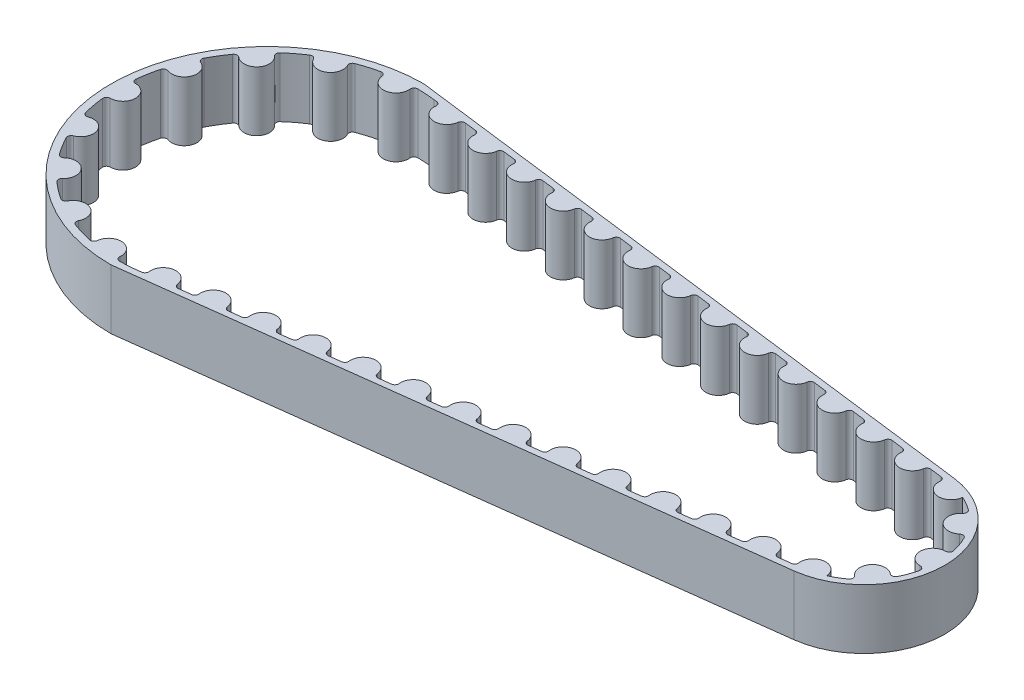
from build123d import *

# Parameters (mm, degrees)
EXTRUDE_1_DEPTH          = 8
EXTRUDE_2_DEPTH          = 8
PATTERN_LINEAR_2_COUNT   = 8
PATTERN_LINEAR_2_PITCH   = 6
PATTERN_LINEAR_3_COUNT   = 7
PATTERN_LINEAR_3_PITCH   = 6
MIRROR_6_COPY_1_DEPTH    = 8
MIRROR_6_COPY_2_DEPTH    = 8
MIRROR_6_COPY_3_DEPTH    = 8
MIRROR_6_COPY_4_DEPTH    = 8
MIRROR_6_COPY_5_DEPTH    = 8
MIRROR_6_COPY_6_DEPTH    = 8
MIRROR_7_COPY_1_DEPTH    = 8
MIRROR_7_COPY_2_DEPTH    = 8
MIRROR_7_COPY_3_DEPTH    = 8
MIRROR_7_COPY_4_DEPTH    = 8
MIRROR_7_COPY_5_DEPTH    = 8
MIRROR_7_COPY_6_DEPTH    = 8
MIRROR_7_COPY_7_DEPTH    = 8
MIRROR_7_COPY_8_DEPTH    = 8
EXTRUDE_4_DEPTH          = 8
PATTERN_CIRCULAR_1_COUNT = 5
PATTERN_CIRCULAR_1_ANGLE = 84
MIRROR_8_COPY_1_DEPTH    = 8
MIRROR_8_COPY_2_DEPTH    = 8
MIRROR_8_COPY_3_DEPTH    = 8
MIRROR_8_COPY_4_DEPTH    = 8
MIRROR_8_COPY_5_DEPTH    = 8
EXTRUDE_5_DEPTH          = 8
PATTERN_CIRCULAR_2_COUNT = 2
PATTERN_CIRCULAR_2_ANGLE = 40
MIRROR_9_COPY_1_DEPTH    = 8
MIRROR_9_COPY_2_DEPTH    = 8


with BuildPart() as part:
    # 草图1 → 凸台-拉伸1 (new body)
    with BuildSketch(Plane(origin=(0, 0, 0), x_dir=(1, 0, 0), z_dir=(0, 1, 0))):
        with BuildLine():
            Line((0, 21), (81.354447298, 10.74431259))
            ThreePointArc((81.354447298, 10.74431259), (90.829348112, 0), (81.354447298, -10.74431259))
            Line((81.354447298, -10.74431259), (0, -21))
            ThreePointArc((0, -21), (-21, 0), (0, 21))
        make_face()
        with BuildLine():
            Line((2.5, 19.843134833), (81.25, 9.921567416))
            ThreePointArc((81.25, 9.921567416), (90, 0), (81.25, -9.921567416))
            Line((81.25, -9.921567416), (2.5, -19.843134833))
            ThreePointArc((2.5, -19.843134833), (-20, 0), (2.5, 19.843134833))
        make_face(mode=Mode.SUBTRACT)
    extrude(amount=EXTRUDE_1_DEPTH)

    # 草图2 → 凸台-拉伸2 (add)
    with BuildSketch(Plane(origin=(0, 0, 0), x_dir=(1, 0, 0), z_dir=(0, 1, 0))):
        with BuildLine():
            Line((38.64552556, 15.28922666), (43.011015223, 14.73922666))
            ThreePointArc((43.011015223, 14.73922666), (42.641929017, 14.638122843), (42.452436852, 14.305648289))
            ThreePointArc((42.452436852, 14.305648289), (40.553270391, 12.831481828), (39.07910393, 14.730648289))
            ThreePointArc((39.07910393, 14.730648289), (38.978000113, 15.099734495), (38.64552556, 15.28922666))
        make_face()
    extrude_2 = extrude(amount=EXTRUDE_2_DEPTH)

    # 阵列(线性)2: 凸台-拉伸2 ×8
    with Locations(*[Vector(0.9921567416492215, 0, 0.12500000000000014) * (i * PATTERN_LINEAR_2_PITCH) for i in range(1, PATTERN_LINEAR_2_COUNT)]):
        add(extrude_2)

    # 阵列(线性)3: 凸台-拉伸2 ×7
    with Locations(*[Vector(-0.9921567416492215, 0, -0.12499999999999983) * (i * PATTERN_LINEAR_3_PITCH) for i in range(1, PATTERN_LINEAR_3_COUNT)]):
        add(extrude_2)

    # 镜向6: 凸台-拉伸2 across plane
    add(extrude_2.mirror(Plane.XY))

    # 镜向6 copy 1 sketch → 镜向6 copy 1 (add)
    with BuildSketch(Plane(origin=(-5.95294045, 0, 0.75), x_dir=(1, 0, 0), z_dir=(0, 1, 0))):
        with BuildLine():
            Line((38.64552556, -15.28922666), (43.011015223, -14.73922666))
            ThreePointArc((43.011015223, -14.73922666), (42.641929017, -14.638122843), (42.452436852, -14.305648289))
            ThreePointArc((42.452436852, -14.305648289), (40.553270391, -12.831481828), (39.07910393, -14.730648289))
            ThreePointArc((39.07910393, -14.730648289), (38.978000113, -15.099734495), (38.64552556, -15.28922666))
        make_face()
    extrude(amount=MIRROR_6_COPY_1_DEPTH)

    # 镜向6 copy 2 sketch → 镜向6 copy 2 (add)
    with BuildSketch(Plane(origin=(-11.9058809, 0, 1.5), x_dir=(1, 0, 0), z_dir=(0, 1, 0))):
        with BuildLine():
            Line((38.64552556, -15.28922666), (43.011015223, -14.73922666))
            ThreePointArc((43.011015223, -14.73922666), (42.641929017, -14.638122843), (42.452436852, -14.305648289))
            ThreePointArc((42.452436852, -14.305648289), (40.553270391, -12.831481828), (39.07910393, -14.730648289))
            ThreePointArc((39.07910393, -14.730648289), (38.978000113, -15.099734495), (38.64552556, -15.28922666))
        make_face()
    extrude(amount=MIRROR_6_COPY_2_DEPTH)

    # 镜向6 copy 3 sketch → 镜向6 copy 3 (add)
    with BuildSketch(Plane(origin=(-17.85882135, 0, 2.25), x_dir=(1, 0, 0), z_dir=(0, 1, 0))):
        with BuildLine():
            Line((38.64552556, -15.28922666), (43.011015223, -14.73922666))
            ThreePointArc((43.011015223, -14.73922666), (42.641929017, -14.638122843), (42.452436852, -14.305648289))
            ThreePointArc((42.452436852, -14.305648289), (40.553270391, -12.831481828), (39.07910393, -14.730648289))
            ThreePointArc((39.07910393, -14.730648289), (38.978000113, -15.099734495), (38.64552556, -15.28922666))
        make_face()
    extrude(amount=MIRROR_6_COPY_3_DEPTH)

    # 镜向6 copy 4 sketch → 镜向6 copy 4 (add)
    with BuildSketch(Plane(origin=(-23.8117618, 0, 3), x_dir=(1, 0, 0), z_dir=(0, 1, 0))):
        with BuildLine():
            Line((38.64552556, -15.28922666), (43.011015223, -14.73922666))
            ThreePointArc((43.011015223, -14.73922666), (42.641929017, -14.638122843), (42.452436852, -14.305648289))
            ThreePointArc((42.452436852, -14.305648289), (40.553270391, -12.831481828), (39.07910393, -14.730648289))
            ThreePointArc((39.07910393, -14.730648289), (38.978000113, -15.099734495), (38.64552556, -15.28922666))
        make_face()
    extrude(amount=MIRROR_6_COPY_4_DEPTH)

    # 镜向6 copy 5 sketch → 镜向6 copy 5 (add)
    with BuildSketch(Plane(origin=(-29.764702249, 0, 3.75), x_dir=(1, 0, 0), z_dir=(0, 1, 0))):
        with BuildLine():
            Line((38.64552556, -15.28922666), (43.011015223, -14.73922666))
            ThreePointArc((43.011015223, -14.73922666), (42.641929017, -14.638122843), (42.452436852, -14.305648289))
            ThreePointArc((42.452436852, -14.305648289), (40.553270391, -12.831481828), (39.07910393, -14.730648289))
            ThreePointArc((39.07910393, -14.730648289), (38.978000113, -15.099734495), (38.64552556, -15.28922666))
        make_face()
    extrude(amount=MIRROR_6_COPY_5_DEPTH)

    # 镜向6 copy 6 sketch → 镜向6 copy 6 (add)
    with BuildSketch(Plane(origin=(-35.717642699, 0, 4.5), x_dir=(1, 0, 0), z_dir=(0, 1, 0))):
        with BuildLine():
            Line((38.64552556, -15.28922666), (43.011015223, -14.73922666))
            ThreePointArc((43.011015223, -14.73922666), (42.641929017, -14.638122843), (42.452436852, -14.305648289))
            ThreePointArc((42.452436852, -14.305648289), (40.553270391, -12.831481828), (39.07910393, -14.730648289))
            ThreePointArc((39.07910393, -14.730648289), (38.978000113, -15.099734495), (38.64552556, -15.28922666))
        make_face()
    extrude(amount=MIRROR_6_COPY_6_DEPTH)

    # 镜向7 copy 1 sketch → 镜向7 copy 1 (add)
    with BuildSketch(Plane(origin=(5.95294045, 0, -0.75), x_dir=(1, 0, 0), z_dir=(0, 1, 0))):
        with BuildLine():
            Line((38.64552556, -15.28922666), (43.011015223, -14.73922666))
            ThreePointArc((43.011015223, -14.73922666), (42.641929017, -14.638122843), (42.452436852, -14.305648289))
            ThreePointArc((42.452436852, -14.305648289), (40.553270391, -12.831481828), (39.07910393, -14.730648289))
            ThreePointArc((39.07910393, -14.730648289), (38.978000113, -15.099734495), (38.64552556, -15.28922666))
        make_face()
    extrude(amount=MIRROR_7_COPY_1_DEPTH)

    # 镜向7 copy 2 sketch → 镜向7 copy 2 (add)
    with BuildSketch(Plane(origin=(11.9058809, 0, -1.5), x_dir=(1, 0, 0), z_dir=(0, 1, 0))):
        with BuildLine():
            Line((38.64552556, -15.28922666), (43.011015223, -14.73922666))
            ThreePointArc((43.011015223, -14.73922666), (42.641929017, -14.638122843), (42.452436852, -14.305648289))
            ThreePointArc((42.452436852, -14.305648289), (40.553270391, -12.831481828), (39.07910393, -14.730648289))
            ThreePointArc((39.07910393, -14.730648289), (38.978000113, -15.099734495), (38.64552556, -15.28922666))
        make_face()
    extrude(amount=MIRROR_7_COPY_2_DEPTH)

    # 镜向7 copy 3 sketch → 镜向7 copy 3 (add)
    with BuildSketch(Plane(origin=(17.85882135, 0, -2.25), x_dir=(1, 0, 0), z_dir=(0, 1, 0))):
        with BuildLine():
            Line((38.64552556, -15.28922666), (43.011015223, -14.73922666))
            ThreePointArc((43.011015223, -14.73922666), (42.641929017, -14.638122843), (42.452436852, -14.305648289))
            ThreePointArc((42.452436852, -14.305648289), (40.553270391, -12.831481828), (39.07910393, -14.730648289))
            ThreePointArc((39.07910393, -14.730648289), (38.978000113, -15.099734495), (38.64552556, -15.28922666))
        make_face()
    extrude(amount=MIRROR_7_COPY_3_DEPTH)

    # 镜向7 copy 4 sketch → 镜向7 copy 4 (add)
    with BuildSketch(Plane(origin=(23.8117618, 0, -3), x_dir=(1, 0, 0), z_dir=(0, 1, 0))):
        with BuildLine():
            Line((38.64552556, -15.28922666), (43.011015223, -14.73922666))
            ThreePointArc((43.011015223, -14.73922666), (42.641929017, -14.638122843), (42.452436852, -14.305648289))
            ThreePointArc((42.452436852, -14.305648289), (40.553270391, -12.831481828), (39.07910393, -14.730648289))
            ThreePointArc((39.07910393, -14.730648289), (38.978000113, -15.099734495), (38.64552556, -15.28922666))
        make_face()
    extrude(amount=MIRROR_7_COPY_4_DEPTH)

    # 镜向7 copy 5 sketch → 镜向7 copy 5 (add)
    with BuildSketch(Plane(origin=(29.764702249, 0, -3.75), x_dir=(1, 0, 0), z_dir=(0, 1, 0))):
        with BuildLine():
            Line((38.64552556, -15.28922666), (43.011015223, -14.73922666))
            ThreePointArc((43.011015223, -14.73922666), (42.641929017, -14.638122843), (42.452436852, -14.305648289))
            ThreePointArc((42.452436852, -14.305648289), (40.553270391, -12.831481828), (39.07910393, -14.730648289))
            ThreePointArc((39.07910393, -14.730648289), (38.978000113, -15.099734495), (38.64552556, -15.28922666))
        make_face()
    extrude(amount=MIRROR_7_COPY_5_DEPTH)

    # 镜向7 copy 6 sketch → 镜向7 copy 6 (add)
    with BuildSketch(Plane(origin=(35.717642699, 0, -4.5), x_dir=(1, 0, 0), z_dir=(0, 1, 0))):
        with BuildLine():
            Line((38.64552556, -15.28922666), (43.011015223, -14.73922666))
            ThreePointArc((43.011015223, -14.73922666), (42.641929017, -14.638122843), (42.452436852, -14.305648289))
            ThreePointArc((42.452436852, -14.305648289), (40.553270391, -12.831481828), (39.07910393, -14.730648289))
            ThreePointArc((39.07910393, -14.730648289), (38.978000113, -15.099734495), (38.64552556, -15.28922666))
        make_face()
    extrude(amount=MIRROR_7_COPY_6_DEPTH)

    # 镜向7 copy 7 sketch → 镜向7 copy 7 (add)
    with BuildSketch(Plane(origin=(41.670583149, 0, -5.25), x_dir=(1, 0, 0), z_dir=(0, 1, 0))):
        with BuildLine():
            Line((38.64552556, -15.28922666), (43.011015223, -14.73922666))
            ThreePointArc((43.011015223, -14.73922666), (42.641929017, -14.638122843), (42.452436852, -14.305648289))
            ThreePointArc((42.452436852, -14.305648289), (40.553270391, -12.831481828), (39.07910393, -14.730648289))
            ThreePointArc((39.07910393, -14.730648289), (38.978000113, -15.099734495), (38.64552556, -15.28922666))
        make_face()
    extrude(amount=MIRROR_7_COPY_7_DEPTH)

    # 镜向7 copy 8 sketch → 镜向7 copy 8 (add)
    with BuildSketch(Plane(origin=(0, 0, 0), x_dir=(1, 0, 0), z_dir=(0, 1, 0))):
        with BuildLine():
            Line((38.64552556, -15.28922666), (43.011015223, -14.73922666))
            ThreePointArc((43.011015223, -14.73922666), (42.641929017, -14.638122843), (42.452436852, -14.305648289))
            ThreePointArc((42.452436852, -14.305648289), (40.553270391, -12.831481828), (39.07910393, -14.730648289))
            ThreePointArc((39.07910393, -14.730648289), (38.978000113, -15.099734495), (38.64552556, -15.28922666))
        make_face()
    extrude(amount=MIRROR_7_COPY_8_DEPTH)

    # 草图3 → 凸台-拉伸4 (add)
    with BuildSketch(Plane(origin=(0, 0, 0), x_dir=(1, 0, 0), z_dir=(0, 1, 0))):
        with BuildLine():
            ThreePointArc((-19.375499994, -1.7), (-17.675499994, 0), (-19.375499994, 1.7))
            ThreePointArc((-19.375499994, 1.7), (-19.748464555, 1.866987334), (-19.872307686, 2.256410256))
            ThreePointArc((-19.872307686, 2.256410256), (-20, 0), (-19.872307686, -2.256410256))
            ThreePointArc((-19.872307686, -2.256410256), (-19.748464555, -1.866987334), (-19.375499994, -1.7))
        make_face()
    extrude_4 = extrude(amount=EXTRUDE_4_DEPTH)

    # 阵列(圆周)1: 凸台-拉伸4 ×5 about axis
    pattern_circular_1_axis = Axis((0, 0, 0), (0, 1, 0))
    for i in range(1, PATTERN_CIRCULAR_1_COUNT):
        add(extrude_4.rotate(pattern_circular_1_axis, i * PATTERN_CIRCULAR_1_ANGLE / (PATTERN_CIRCULAR_1_COUNT - 1)))

    # 镜向8 copy 1 sketch → 镜向8 copy 1 (add)
    with BuildSketch(Plane(origin=(0, 0, 0), x_dir=(0.9335804264972015, 0, 0.358367949545301), z_dir=(0, 1, 0))):
        with BuildLine():
            ThreePointArc((-19.375499994, 1.7), (-17.675499994, 0), (-19.375499994, -1.7))
            ThreePointArc((-19.375499994, -1.7), (-19.748464555, -1.866987334), (-19.872307686, -2.256410256))
            ThreePointArc((-19.872307686, -2.256410256), (-20, 0), (-19.872307686, 2.256410256))
            ThreePointArc((-19.872307686, 2.256410256), (-19.748464555, 1.866987334), (-19.375499994, 1.7))
        make_face()
    extrude(amount=MIRROR_8_COPY_1_DEPTH)

    # 镜向8 copy 2 sketch → 镜向8 copy 2 (add)
    with BuildSketch(Plane(origin=(0, 0, 0), x_dir=(0.7431448254773931, 0, 0.6691306063588593), z_dir=(0, 1, 0))):
        with BuildLine():
            ThreePointArc((-19.375499994, 1.7), (-17.675499994, 0), (-19.375499994, -1.7))
            ThreePointArc((-19.375499994, -1.7), (-19.748464555, -1.866987334), (-19.872307686, -2.256410256))
            ThreePointArc((-19.872307686, -2.256410256), (-20, 0), (-19.872307686, 2.256410256))
            ThreePointArc((-19.872307686, 2.256410256), (-19.748464555, 1.866987334), (-19.375499994, 1.7))
        make_face()
    extrude(amount=MIRROR_8_COPY_2_DEPTH)

    # 镜向8 copy 3 sketch → 镜向8 copy 3 (add)
    with BuildSketch(Plane(origin=(0, 0, 0), x_dir=(0.45399049973954464, 0, 0.8910065241883689), z_dir=(0, 1, 0))):
        with BuildLine():
            ThreePointArc((-19.375499994, 1.7), (-17.675499994, 0), (-19.375499994, -1.7))
            ThreePointArc((-19.375499994, -1.7), (-19.748464555, -1.866987334), (-19.872307686, -2.256410256))
            ThreePointArc((-19.872307686, -2.256410256), (-20, 0), (-19.872307686, 2.256410256))
            ThreePointArc((-19.872307686, 2.256410256), (-19.748464555, 1.866987334), (-19.375499994, 1.7))
        make_face()
    extrude(amount=MIRROR_8_COPY_3_DEPTH)

    # 镜向8 copy 4 sketch → 镜向8 copy 4 (add)
    with BuildSketch(Plane(origin=(0, 0, 0), x_dir=(0.10452846326765036, 0, 0.9945218953682736), z_dir=(0, 1, 0))):
        with BuildLine():
            ThreePointArc((-19.375499994, 1.7), (-17.675499994, 0), (-19.375499994, -1.7))
            ThreePointArc((-19.375499994, -1.7), (-19.748464555, -1.866987334), (-19.872307686, -2.256410256))
            ThreePointArc((-19.872307686, -2.256410256), (-20, 0), (-19.872307686, 2.256410256))
            ThreePointArc((-19.872307686, 2.256410256), (-19.748464555, 1.866987334), (-19.375499994, 1.7))
        make_face()
    extrude(amount=MIRROR_8_COPY_4_DEPTH)

    # 镜向8 copy 5 sketch → 镜向8 copy 5 (add)
    with BuildSketch(Plane(origin=(0, 0, 0), x_dir=(1, 0, 0), z_dir=(0, 1, 0))):
        with BuildLine():
            ThreePointArc((-19.375499994, 1.7), (-17.675499994, 0), (-19.375499994, -1.7))
            ThreePointArc((-19.375499994, -1.7), (-19.748464555, -1.866987334), (-19.872307686, -2.256410256))
            ThreePointArc((-19.872307686, -2.256410256), (-20, 0), (-19.872307686, 2.256410256))
            ThreePointArc((-19.872307686, 2.256410256), (-19.748464555, 1.866987334), (-19.375499994, 1.7))
        make_face()
    extrude(amount=MIRROR_8_COPY_5_DEPTH)

    # 草图4 → 凸台-拉伸5 (add)
    with BuildSketch(Plane(origin=(0, 0, 0), x_dir=(1, 0, 0), z_dir=(0, 1, 0))):
        with BuildLine():
            ThreePointArc((89.24175308, 1.7), (87.54175308, 0), (89.24175308, -1.7))
            ThreePointArc((89.24175308, -1.7), (89.634114353, -1.89007641), (89.728161137, -2.315789474))
            ThreePointArc((89.728161137, -2.315789474), (90, 0), (89.728161137, 2.315789474))
            ThreePointArc((89.728161137, 2.315789474), (89.634114353, 1.89007641), (89.24175308, 1.7))
        make_face()
    extrude_5 = extrude(amount=EXTRUDE_5_DEPTH)

    # 阵列(圆周)2: 凸台-拉伸5 ×2 about axis
    pattern_circular_2_axis = Axis((80, 0, 0), (0, 1, 0))
    for i in range(1, PATTERN_CIRCULAR_2_COUNT):
        add(extrude_5.rotate(pattern_circular_2_axis, i * PATTERN_CIRCULAR_2_ANGLE / (PATTERN_CIRCULAR_2_COUNT - 1)))

    # 镜向9 copy 1 sketch → 镜向9 copy 1 (add)
    with BuildSketch(Plane(origin=(18.71644455, 0, -51.423008775), x_dir=(0.766044443118977, 0, 0.6427876096865406), z_dir=(0, 1, 0))):
        with BuildLine():
            ThreePointArc((89.24175308, -1.7), (87.54175308, 0), (89.24175308, 1.7))
            ThreePointArc((89.24175308, 1.7), (89.634114353, 1.89007641), (89.728161137, 2.315789474))
            ThreePointArc((89.728161137, 2.315789474), (90, 0), (89.728161137, -2.315789474))
            ThreePointArc((89.728161137, -2.315789474), (89.634114353, -1.89007641), (89.24175308, -1.7))
        make_face()
    extrude(amount=MIRROR_9_COPY_1_DEPTH)

    # 镜向9 copy 2 sketch → 镜向9 copy 2 (add)
    with BuildSketch(Plane(origin=(0, 0, 0), x_dir=(1, 0, 0), z_dir=(0, 1, 0))):
        with BuildLine():
            ThreePointArc((89.24175308, -1.7), (87.54175308, 0), (89.24175308, 1.7))
            ThreePointArc((89.24175308, 1.7), (89.634114353, 1.89007641), (89.728161137, 2.315789474))
            ThreePointArc((89.728161137, 2.315789474), (90, 0), (89.728161137, -2.315789474))
            ThreePointArc((89.728161137, -2.315789474), (89.634114353, -1.89007641), (89.24175308, -1.7))
        make_face()
    extrude(amount=MIRROR_9_COPY_2_DEPTH)


solid = part.part
